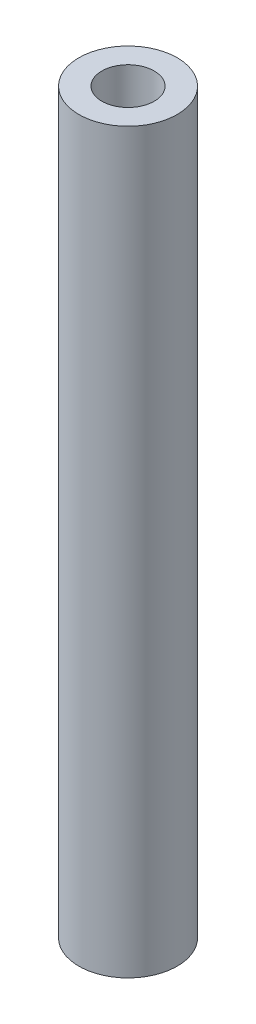
from build123d import *

# Parameters (mm, degrees)
SKETCH1_R           = 3
SKETCH1_R_2         = 1.6
BOSS_EXTRUDE1_DEPTH = 45


with BuildPart() as part:
    # Sketch1 → Boss-Extrude1 (new body)
    with BuildSketch(Plane(origin=(0, 0, 0), x_dir=(1, 0, 0), z_dir=(0, 1, 0))):
        with Locations(Location((0, 0, 0), (0, 0, 90))):
            Circle(SKETCH1_R)
        with Locations(Location((0, 0, 0), (0, 0, 90))):
            Circle(SKETCH1_R_2, mode=Mode.SUBTRACT)
    extrude(amount=BOSS_EXTRUDE1_DEPTH)


solid = part.part
